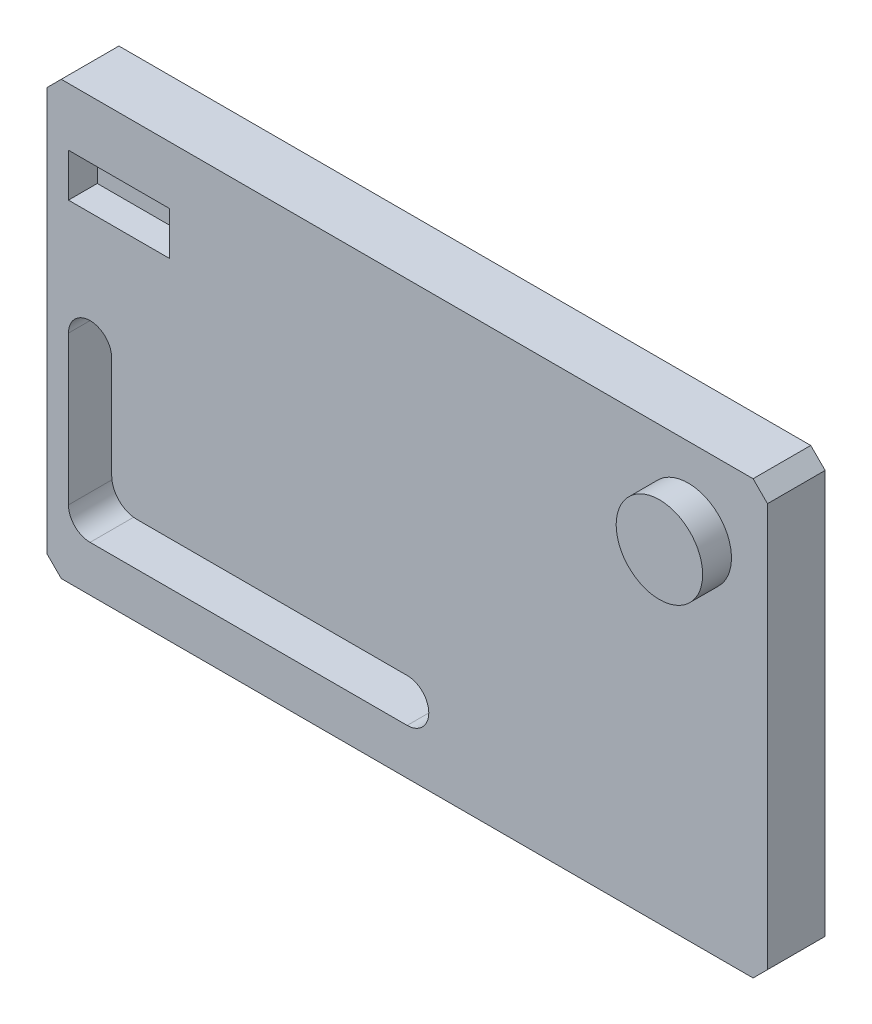
from build123d import *

# Parameters (mm, degrees)
SKETCH1_W           = 25
SKETCH1_H           = 15
BOSS_EXTRUDE1_DEPTH = 2
CHAMFER1_SIZE       = 0.5
SKETCH2_R           = 1.5
BOSS_EXTRUDE2_DEPTH = 1
SKETCH3_W           = 3.5
SKETCH3_H           = 1.5
CUT_EXTRUDE1_DEPTH  = 1
CUT_EXTRUDE2_REACH  = 16.714
CUT_EXTRUDE3_REACH  = 16.714
FILLET2_R           = 0.875


with BuildPart() as part:
    # Sketch1 → Boss-Extrude1 (new body)
    with BuildSketch(Plane.XY):
        Rectangle(SKETCH1_W, SKETCH1_H)
    extrude(amount=BOSS_EXTRUDE1_DEPTH)

    # Chamfer1
    chamfer1_edges = [part.edges().sort_by_distance(p)[0] for p in [
        (-12.5, -7.5, 1),
        (12.5, -7.5, 1),
        (12.5, 7.5, 1),
        (-12.5, 7.5, 1),
    ]]
    chamfer(chamfer1_edges, length=CHAMFER1_SIZE)

    # Sketch2 → Boss-Extrude2 (add)
    with BuildSketch(Plane.XY.offset(2)):
        with Locations(Location((9.75, 4.7447, 0), (0, 0, 180))):
            Circle(SKETCH2_R)
    extrude(amount=BOSS_EXTRUDE2_DEPTH)

    # Sketch3 → Cut-Extrude1 (cut)
    with BuildSketch(Plane.XY.offset(2)):
        with Locations((-10, 4.7447)):
            Rectangle(SKETCH3_W, SKETCH3_H)
    extrude(amount=-CUT_EXTRUDE1_DEPTH, mode=Mode.SUBTRACT)

    # Sketch4 → Cut-Extrude2 (cut, up to next)
    with BuildSketch(Plane.XY.offset(2), mode=Mode.PRIVATE) as cut_extrude2_sk1:
        with BuildLine():
            Line((-11, -4.411618673), (0, -4.411618673))
            ThreePointArc((0, -4.411618673), (0.75, -5.161618673), (0, -5.911618673))
            Line((0, -5.911618673), (-11, -5.911618673))
            ThreePointArc((-11, -5.911618673), (-11.75, -5.161618673), (-11, -4.411618673))
        make_face()
    cut_extrude2_tool1 = extrude(cut_extrude2_sk1.sketch, amount=-CUT_EXTRUDE2_REACH, mode=Mode.PRIVATE) & part.part
    add(cut_extrude2_tool1.solids().sort_by_distance((-5.5, -5.161619, 2))[0], mode=Mode.SUBTRACT)

    # Sketch4<4> → Cut-Extrude3 (cut, up to next)
    with BuildSketch(Plane.XY.offset(2), mode=Mode.PRIVATE) as cut_extrude3_sk1:
        with BuildLine():
            Line((-11.75, -5.161618673), (-11.75, 0))
            ThreePointArc((-11.75, 0), (-11, 0.75), (-10.25, 0))
            Line((-10.25, 0), (-10.25, -5.161618673))
            ThreePointArc((-10.25, -5.161618673), (-11, -5.911618673), (-11.75, -5.161618673))
        make_face()
    cut_extrude3_tool1 = extrude(cut_extrude3_sk1.sketch, amount=-CUT_EXTRUDE3_REACH, mode=Mode.PRIVATE) & part.part
    add(cut_extrude3_tool1.solids().sort_by_distance((-11, -2.580809, 2))[0], mode=Mode.SUBTRACT)

    # Fillet2
    fillet2_edges = [part.edges().sort_by_distance(p)[0] for p in [
        (-10.25, -4.411618673, 1),
    ]]
    fillet(fillet2_edges, radius=FILLET2_R)


solid = part.part
